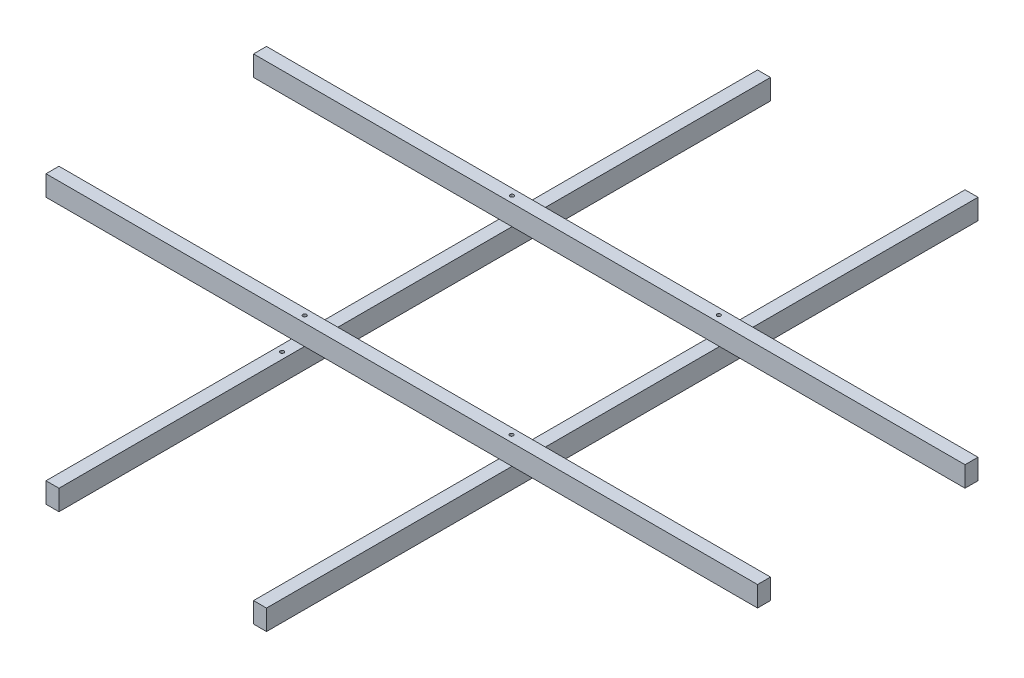
from build123d import *

# Parameters (mm, degrees)
SKETCH1_W              = 88.9
SKETCH1_H              = 139.7
PROFILES_4X6_1_DEPTH   = 4876.8
SKETCH1_ON_SEGMENT_2_W = 88.9
SKETCH1_ON_SEGMENT_2_H = 139.7
PROFILES_4X6_1_2_DEPTH = 4876.8
SKETCH1_ON_SEGMENT_3_W = 88.9
SKETCH1_ON_SEGMENT_3_H = 139.7
PROFILES_4X6_1_3_DEPTH = 4876.8
SKETCH1_ON_SEGMENT_4_W = 88.9
SKETCH1_ON_SEGMENT_4_H = 139.7
PROFILES_4X6_1_4_DEPTH = 4876.8
SKETCH13_R             = 12.7
CUT_EXTRUDE1_DEPTH     = 6691.622287949
SKETCH15_R             = 12.7
CUT_EXTRUDE5_DEPTH     = 6687.245458402


with BuildPart() as part:
    # Sketch1 → Profiles 4X6(1) (new body)
    with BuildSketch(Plane(origin=(1422.4, 0, 0), x_dir=(-1, 0, 0), z_dir=(0, 0, -1))):
        Rectangle(SKETCH1_W, SKETCH1_H)
    extrude(amount=PROFILES_4X6_1_DEPTH)


with BuildPart() as body_2:
    # Sketch1 on segment 2 (carried to segment 2) → Profiles 4X6_1 2 (new body)
    with BuildSketch(Plane(origin=(2844.8, 0, 0), x_dir=(-1, 0, 0), z_dir=(0, 0, -1))):
        Rectangle(SKETCH1_ON_SEGMENT_2_W, SKETCH1_ON_SEGMENT_2_H)
    extrude(amount=PROFILES_4X6_1_2_DEPTH)


with BuildPart() as body_3:
    # Sketch1 on segment 3 (carried to segment 3) → Profiles 4X6_1 3 (new body)
    with BuildSketch(Plane(origin=(-304.8, 139.7, -3149.6), x_dir=(0, 0, -1), z_dir=(1, 0, 0))):
        Rectangle(SKETCH1_ON_SEGMENT_3_W, SKETCH1_ON_SEGMENT_3_H)
    extrude(amount=PROFILES_4X6_1_3_DEPTH)


with BuildPart() as body_4:
    # Sketch1 on segment 4 (carried to segment 4) → Profiles 4X6_1 4 (new body)
    with BuildSketch(Plane(origin=(4572, 139.7, -1727.2), x_dir=(0, 0, 1), z_dir=(-1, 0, 0))):
        Rectangle(SKETCH1_ON_SEGMENT_4_W, SKETCH1_ON_SEGMENT_4_H)
    extrude(amount=PROFILES_4X6_1_4_DEPTH)


with BuildPart() as cut_extrude1_tool:
    # Sketch13 → Cut-Extrude1 (new, through all)
    with BuildSketch(Plane(origin=(0, 209.55, 0), x_dir=(1, 0, 0), z_dir=(0, 1, 0))):
        with Locations(Location((1422.4, 3149.6, 0), (0, 0, 270))):
            Circle(SKETCH13_R)
        with Locations(Location((2840.257577537, 3149.6, 0), (0, 0, 270))):
            Circle(SKETCH13_R)
        with Locations(Location((1422.4, 1728.393041163, 0), (0, 0, 270))):
            Circle(SKETCH13_R)
        with Locations(Location((2840.257577537, 1728.393041163, 0), (0, 0, 270))):
            Circle(SKETCH13_R)
    extrude(amount=-CUT_EXTRUDE1_DEPTH)


with BuildPart() as part_1:
    add(part.part)

    # Cut-Extrude1: cut by cut_extrude1_tool
    add(cut_extrude1_tool.part, mode=Mode.SUBTRACT)

    # Sketch15 → Cut-Extrude5 (cut, through all)
    with BuildSketch(Plane(origin=(0, 69.85, 0), x_dir=(1, 0, 0), z_dir=(0, 1, 0))):
        with Locations(Location((1422.19609917, 1574.261712408, 0), (0, 0, 180))):
            Circle(SKETCH15_R)
        with Locations(Location((1422.19609917, 3186.474586948, 0), (0, 0, 180))):
            Circle(SKETCH15_R)
    extrude(amount=-CUT_EXTRUDE5_DEPTH, mode=Mode.SUBTRACT)


with BuildPart() as body_2_1:
    add(body_2.part)

    # Cut-Extrude1: cut by cut_extrude1_tool
    add(cut_extrude1_tool.part, mode=Mode.SUBTRACT)


with BuildPart() as body_3_1:
    add(body_3.part)

    # Cut-Extrude1: cut by cut_extrude1_tool
    add(cut_extrude1_tool.part, mode=Mode.SUBTRACT)


with BuildPart() as body_4_1:
    add(body_4.part)

    # Cut-Extrude1: cut by cut_extrude1_tool
    add(cut_extrude1_tool.part, mode=Mode.SUBTRACT)


solid = Compound([part_1.part, body_2_1.part, body_3_1.part, body_4_1.part])
